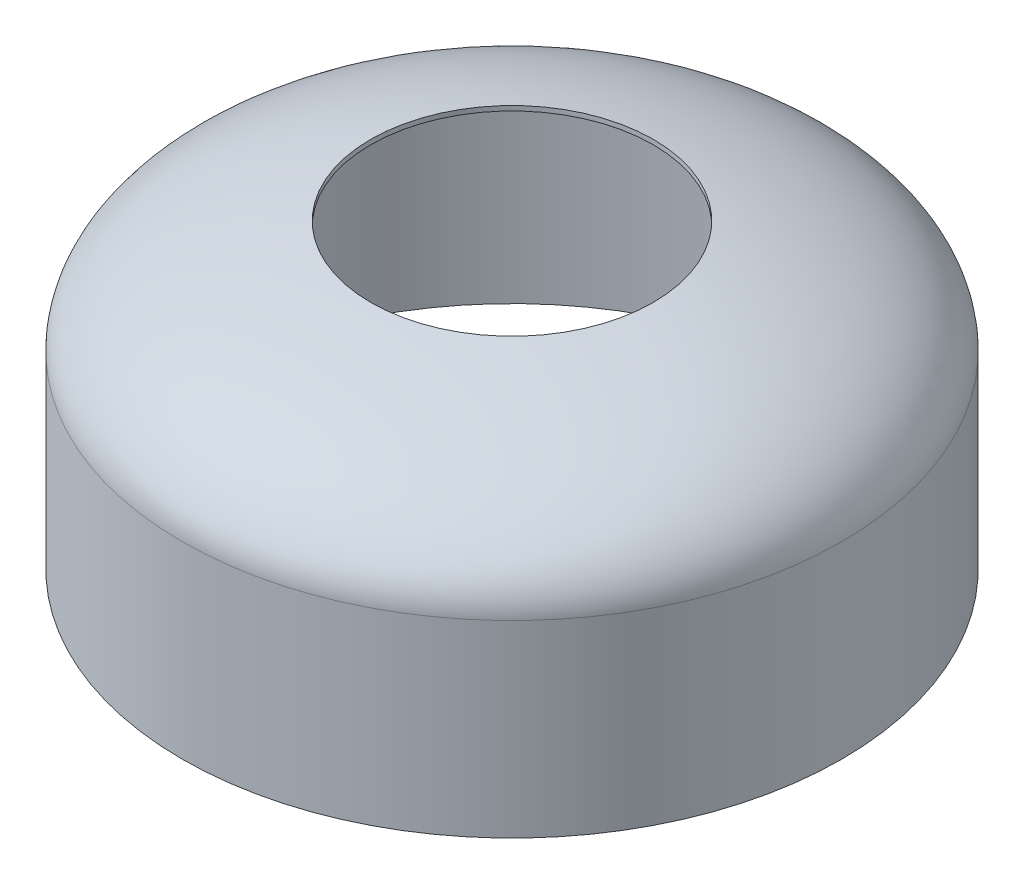
from build123d import *


with BuildPart() as part:
    # Sketch1 → Revolve1 (revolve)
    with BuildSketch(Plane.XY, mode=Mode.PRIVATE) as revolve1_sk:
        with BuildLine():
            Line((175.26, -101.6), (175.26, 0))
            add(Edge.make_bspline(
                [(175.26, 0), (175.26, 40.716969697), (76.2, 58.42)],
                knots=[0, 0, 0, 1.120999466, 1.120999466, 1.120999466], degree=2, weights=[1, 0.846989554, 1]))
            Line((76.2, 58.42), (76.2, 60.96))
            add(Edge.make_bspline(
                [(177.8, 0), (177.8, 42.672), (76.2, 60.96)],
                knots=[0, 0, 0, 1.127885283, 1.127885283, 1.127885283], degree=2, weights=[1, 0.845154255, 1]))
            Line((177.8, 0), (177.8, -101.6))
            Line((177.8, -101.6), (175.26, -101.6))
        make_face()
    revolve(revolve1_sk.sketch.rotate(Axis((0, -109.728, 0), (0, 1, 0)), 90), axis=Axis((0, -109.728, 0), (0, 1, 0)))


solid = part.part
